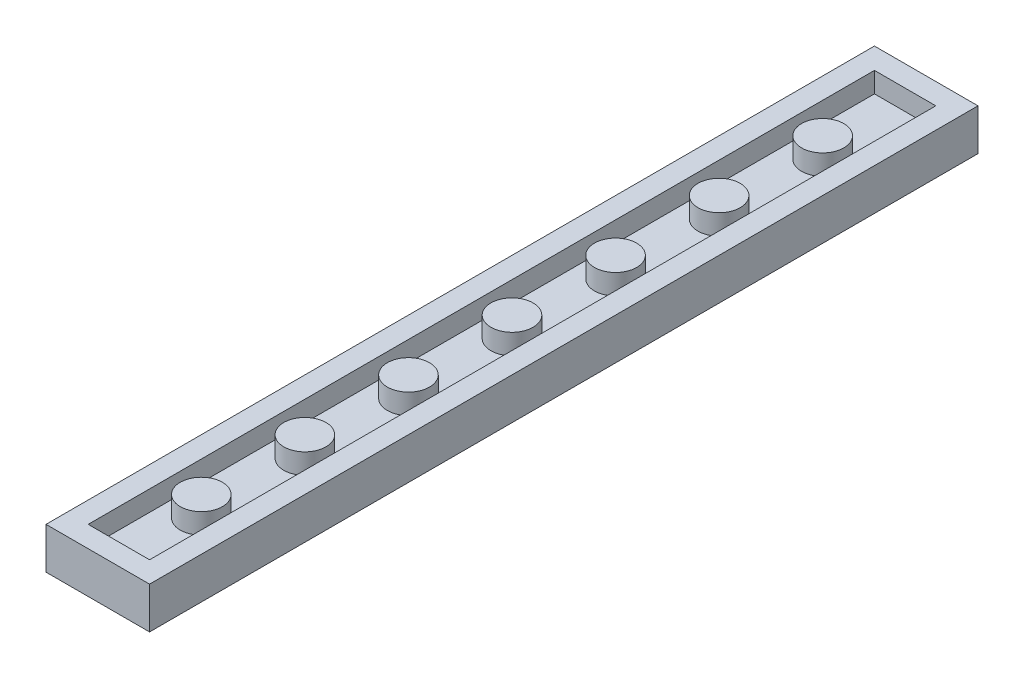
from build123d import *

# Parameters (mm, degrees)
SKETCH1_W           = 8.065
SKETCH1_H           = 64.52
BOSS_EXTRUDE1_DEPTH = 3.226
CUT_EXTRUDE1_DEPTH  = 1.5835
SKETCH7_W           = 1.6425
SKETCH7_H           = 1.5835
SKETCH8_W           = 1.6425
SKETCH8_H           = 1.5835
SKETCH9_W           = 1.6425
SKETCH9_H           = 1.5835
LPATTERN1_COUNT     = 5
LPATTERN1_PITCH     = 8.065


with BuildPart() as part:
    # Sketch1 → Boss-Extrude1 (new body)
    with BuildSketch(Plane(origin=(0, 3.226, 0), x_dir=(1, 0, 0), z_dir=(0, 1, 0))):
        with Locations((0, 16.13)):
            Rectangle(SKETCH1_W, SKETCH1_H)
    extrude(amount=-BOSS_EXTRUDE1_DEPTH)

    # Sketch2 → Cut-Extrude1 (cut)
    with BuildSketch(Plane(origin=(0, 3.226, 0), x_dir=(-1, 0, 0), z_dir=(0, 1, 0))):
        Polygon((2.39, 14.4875), (-2.39, 14.4875), (-2.39, -14.4875), (-2.39, -46.7475), (2.39, -46.7475), (2.39, -14.4875), align=None)
    extrude(amount=-CUT_EXTRUDE1_DEPTH, mode=Mode.SUBTRACT)

    # Sketch7 → Revolve5 (revolve)
    with BuildSketch(Plane(origin=(0, 0, -8.065), x_dir=(-1, 0, 0), z_dir=(0, 0, -1)), mode=Mode.PRIVATE) as revolve5_sk:
        with Locations((-0.82125, 2.43425)):
            Rectangle(SKETCH7_W, SKETCH7_H)
    revolve5 = revolve(revolve5_sk.sketch.rotate(Axis((0, 1.6425, -8.065), (0, 1, 0)), 270), axis=Axis((0, 1.6425, -8.065), (0, 1, 0)))

    # Sketch8 → Revolve6 (revolve)
    with BuildSketch(Plane(origin=(0, 0, 0), x_dir=(-1, 0, 0), z_dir=(0, 0, -1)), mode=Mode.PRIVATE) as revolve6_sk:
        with Locations((-0.82125, 2.43425)):
            Rectangle(SKETCH8_W, SKETCH8_H)
    revolve(revolve6_sk.sketch.rotate(Axis((0, 1.6425, 0), (0, 1, 0)), 270), axis=Axis((0, 1.6425, 0), (0, 1, 0)))

    # Sketch9 → Revolve7 (revolve)
    with BuildSketch(Plane(origin=(0, 0, 8.065), x_dir=(-1, 0, 0), z_dir=(0, 0, -1)), mode=Mode.PRIVATE) as revolve7_sk:
        with Locations((-0.82125, 2.43425)):
            Rectangle(SKETCH9_W, SKETCH9_H)
    revolve(revolve7_sk.sketch.rotate(Axis((0, 1.6425, 8.065), (0, 1, 0)), 270), axis=Axis((0, 1.6425, 8.065), (0, 1, 0)))

    # LPattern1: Revolve5 ×5
    with Locations(*[(0, 0, -i * LPATTERN1_PITCH) for i in range(1, LPATTERN1_COUNT)]):
        add(revolve5)


solid = part.part
